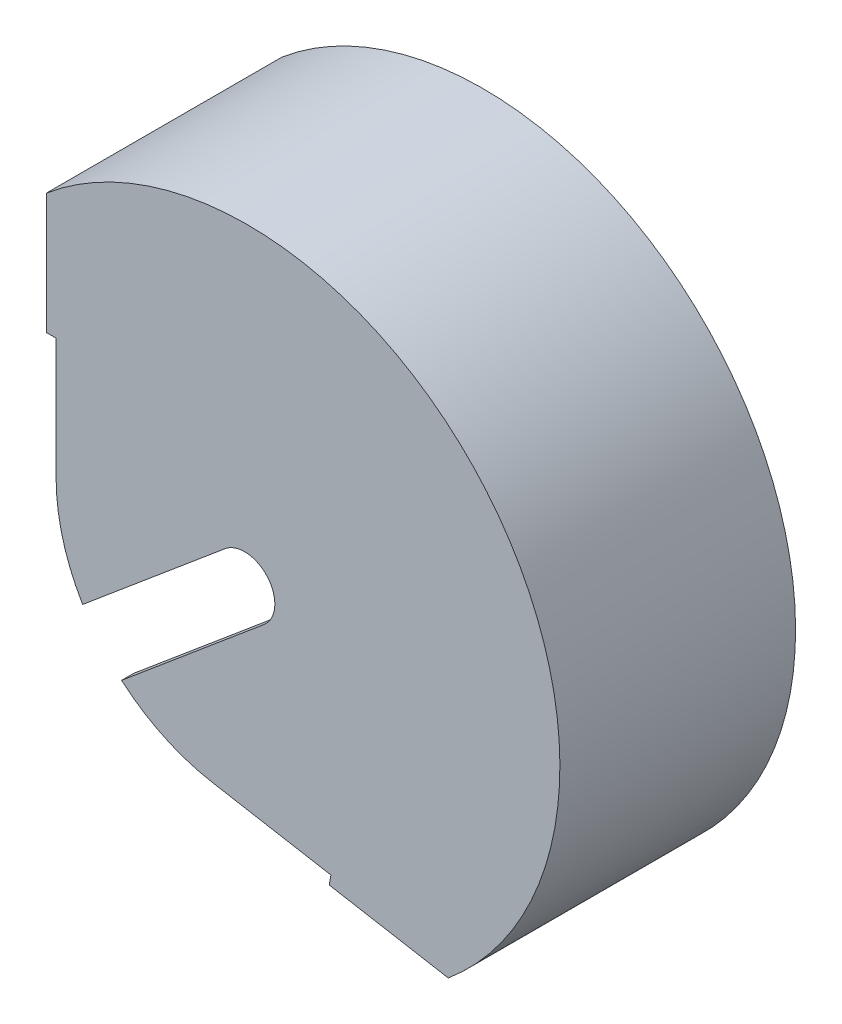
from build123d import *

# Parameters (mm, degrees)
SIDE_DEPTH             = 2.54
COVER_DEPTH            = 44.45
FLYWHEEL_SLIT_REACH    = 107.934
MOUNT_HOLES_REACH      = 107.934
SKETCH4_R              = 3.2639
AXLE_HOLDER_HOLE_REACH = 107.934
SKETCH5_R              = 3.81


with BuildPart() as part:
    # Sketch1 → Side (new body)
    with BuildSketch(Plane.XY):
        with BuildLine():
            Line((17.780628438, -45.433815472), (42.794745364, -49.844479185))
            ThreePointArc((42.794745364, -49.844479185), (50.891612275, 42.70313309), (-41.656, 50.8))
            Line((-41.656, 50.8), (-41.656, 25.4))
            Line((-41.656, 25.4), (-39.624, 25.4))
            Line((-39.624, 25.4), (-39.624, 0))
            Line((-39.624, 0), (0, 0))
            Line((0, 0), (-6.880635392, -39.022022405))
            Line((-6.880635392, -39.022022405), (18.133481535, -43.432686118))
            Line((18.133481535, -43.432686118), (17.780628438, -45.433815472))
        make_face()
        with BuildLine():
            Line((0, 0), (-39.624, 0))
            ThreePointArc((-39.624, 0), (-30.353745014, -25.469816246), (-6.880635392, -39.022022405))
            Line((-6.880635392, -39.022022405), (0, 0))
        make_face()
    side = extrude(amount=SIDE_DEPTH)

    # Sketch2 → Cover (add)
    with BuildSketch(Plane.XY.offset(2.54)):
        with BuildLine():
            Line((-40.023319471, 48.854247114), (-41.656, 48.854247114))
            Line((-41.656, 48.854247114), (-41.656, 50.8))
            ThreePointArc((-41.656, 50.8), (50.891612275, 42.70313309), (42.794745364, -49.844479185))
            Line((42.794745364, -49.844479185), (40.878552837, -49.506602742))
            Line((40.878552837, -49.506602742), (41.162064836, -47.898726299))
            ThreePointArc((41.162064836, -47.898726299), (48.945859389, 41.070452561), (-40.023319471, 48.854247114))
        make_face()
    extrude(amount=COVER_DEPTH)

    # Mirror1: Side across plane
    add(side.mirror(Plane.XY.offset(24.765)))

    # Sketch3 → Flywheel slit (cut, up to next)
    with BuildSketch(Plane.XY.offset(49.53), mode=Mode.PRIVATE) as flywheel_slit_sk1:
        with BuildLine():
            Line((-4.081701322, 4.864382214), (-37.159500375, -22.891186772))
            Line((-37.159500375, -22.891186772), (-28.996097732, -32.6199512))
            Line((-28.996097732, -32.6199512), (4.081701322, -4.864382214))
            ThreePointArc((4.081701322, -4.864382214), (4.864382214, 4.081701322), (-4.081701322, 4.864382214))
        make_face()
    flywheel_slit_tool1 = extrude(flywheel_slit_sk1.sketch, amount=-FLYWHEEL_SLIT_REACH, mode=Mode.PRIVATE) & part.part
    add(flywheel_slit_tool1.solids().sort_by_distance((-14.612688, -12.261501, 49.53))[0], mode=Mode.SUBTRACT)

    # Sketch4 → Mount holes (cut, up to next)
    with BuildSketch(Plane(origin=(0, 0, 0), x_dir=(-1, 0, 0), z_dir=(0, 0, -1)), mode=Mode.PRIVATE) as mount_holes_sk1:
        with Locations((-2.116217682, -33.531680079)):
            Circle(SKETCH4_R)
    mount_holes_tool1 = extrude(mount_holes_sk1.sketch, amount=-MOUNT_HOLES_REACH, mode=Mode.PRIVATE) & part.part
    # Sketch4 → Mount holes (cut, up to next)
    with BuildSketch(Plane(origin=(0, 0, 0), x_dir=(-1, 0, 0), z_dir=(0, 0, -1)), mode=Mode.PRIVATE) as mount_holes_sk2:
        with Locations((33.277492898, 10.173950581)):
            Circle(SKETCH4_R)
    mount_holes_tool2 = extrude(mount_holes_sk2.sketch, amount=-MOUNT_HOLES_REACH, mode=Mode.PRIVATE) & part.part
    add(mount_holes_tool1.solids().sort_by_distance((2.116218, -33.53168, 0))[0], mode=Mode.SUBTRACT)
    add(mount_holes_tool2.solids().sort_by_distance((-33.277493, 10.173951, 0))[0], mode=Mode.SUBTRACT)

    # Sketch5 → Axle Holder Hole (cut, up to next)
    with BuildSketch(Plane(origin=(0, 0, 0), x_dir=(-1, 0, 0), z_dir=(0, 0, -1)), mode=Mode.PRIVATE) as axle_holder_hole_sk1:
        Circle(SKETCH5_R)
    axle_holder_hole_tool1 = extrude(axle_holder_hole_sk1.sketch, amount=-AXLE_HOLDER_HOLE_REACH, mode=Mode.PRIVATE) & part.part
    add(axle_holder_hole_tool1.solids().sort_by_distance((0, 0, 0))[0], mode=Mode.SUBTRACT)


solid = part.part
